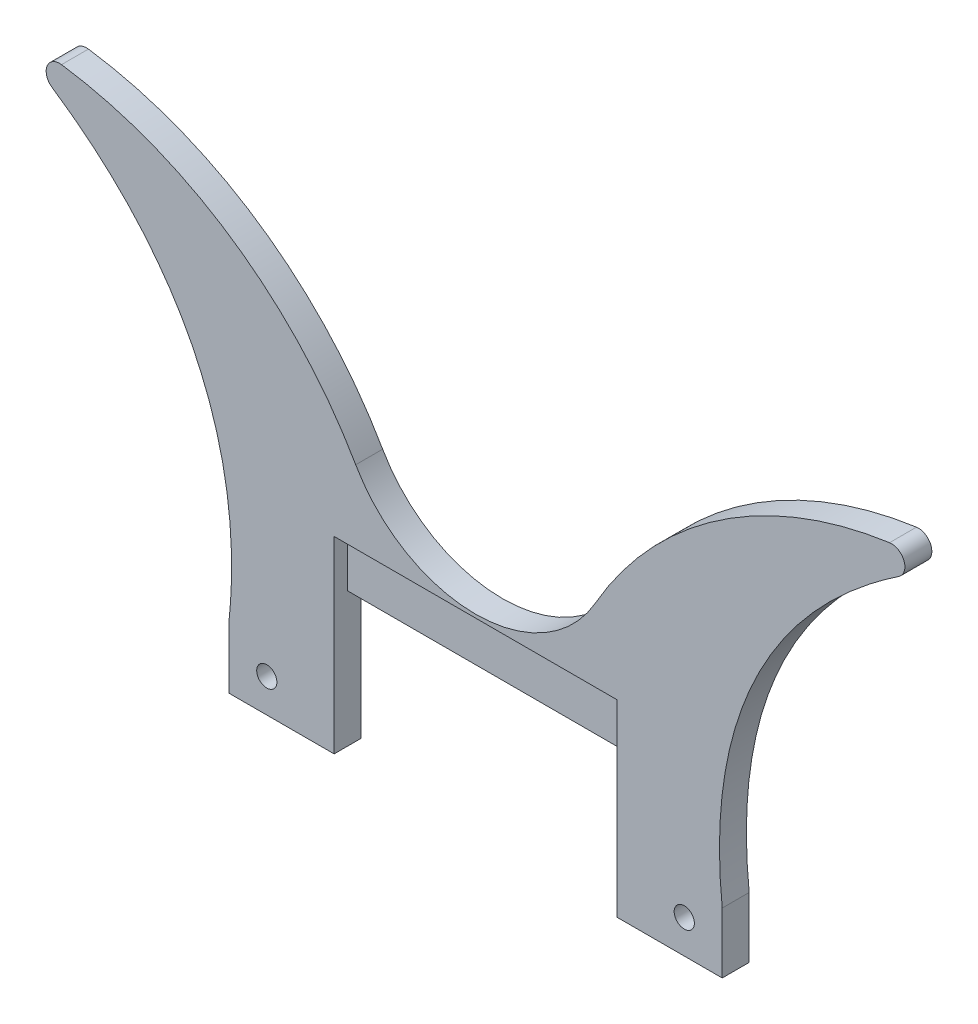
from build123d import *

# Parameters (mm, degrees)
EXTRUDE_1_DEPTH     = 3
SKETCH_2_W          = 42
SKETCH_2_H          = 10.974531836
CUT_EXTRUDE_1_DEPTH = 3
SKETCH_3_W          = 15.635920588
SKETCH_3_H          = 9
SKETCH_3_R          = 1.5
EXTRUDE_2_DEPTH     = 3
EXTRUDE_7_DEPTH     = 1
SKETCH_5_W          = 42
SKETCH_5_H          = 8
CUT_EXTRUDE_2_DEPTH = 1
SKETCH_6_R          = 1.5
CUT_EXTRUDE_3_DEPTH = 1


with BuildPart() as part:
    # 草图1 → 凸台-拉伸1 (new body)
    with BuildSketch(Plane.XY):
        with BuildLine():
            Line((36.635920588, -39.974531836), (-36.635920588, -39.974531836))
            add(Edge.make_bspline(
                [(-36.635920588, -39.974531836), (-34.121545097, -16.704406605), (-43.139592985, 2.527664637), (-62.878950173, 15.795774826)],
                knots=[0, 0, 0, 0, 0.89990839, 0.89990839, 0.89990839, 0.89990839], degree=3))
            ThreePointArc((-62.878950173, 15.795774826), (-63.630739893, 18.171500647), (-61.483579663, 19.436002094))
            ThreePointArc((-61.483579663, 19.436002094), (-36.207222823, 9.690254792), (-17.793837687, -10.179849722))
            ThreePointArc((-17.793837687, -10.179849722), (0, -20.5), (17.793837687, -10.179849722))
            ThreePointArc((17.793837687, -10.179849722), (36.207222823, 9.690254792), (61.483579663, 19.436002094))
            ThreePointArc((61.483579663, 19.436002094), (63.630739893, 18.171500647), (62.878950173, 15.795774826))
            add(Edge.make_bspline(
                [(36.635920588, -39.974531836), (34.121545097, -16.704406605), (43.139592985, 2.527664637), (62.878950173, 15.795774826)],
                knots=[0, 0, 0, 0, 0.89990839, 0.89990839, 0.89990839, 0.89990839], degree=3))
        make_face()
    extrude(amount=EXTRUDE_1_DEPTH)

    # 草图2 → 切除-拉伸1 (cut)
    with BuildSketch(Plane(origin=(0, 0, 0), x_dir=(-1, 0, 0), z_dir=(0, 0, -1))):
        with Locations((0, -34.487265918)):
            Rectangle(SKETCH_2_W, SKETCH_2_H)
    extrude(amount=-CUT_EXTRUDE_1_DEPTH, mode=Mode.SUBTRACT)

    # 草图3 → 凸台-拉伸2 (add)
    # profile 1 of 2: a face of its own
    with BuildSketch(Plane(origin=(0, 0, 0), x_dir=(-1, 0, 0), z_dir=(0, 0, -1))):
        with Locations((-28.817960294, -44.474531836)):
            Rectangle(SKETCH_3_W, SKETCH_3_H)
        with Locations((-31, -44)):
            Circle(SKETCH_3_R, mode=Mode.SUBTRACT)
    # profile 2 of 2: a face of its own
    with BuildSketch(Plane(origin=(0, 0, 0), x_dir=(-1, 0, 0), z_dir=(0, 0, -1))):
        with Locations((28.817960294, -44.474531836)):
            Rectangle(SKETCH_3_W, SKETCH_3_H)
        with Locations(Location((31, -44, 0), (0, 0, 180))):
            Circle(SKETCH_3_R, mode=Mode.SUBTRACT)
    extrude(amount=-EXTRUDE_2_DEPTH)

    # 草图4 → 凸台-拉伸7 (add)
    with BuildSketch(Plane.XY.offset(3)):
        with BuildLine():
            Line((-21, -29), (-21, -21))
            Line((-21, -21), (21, -21))
            Line((21, -21), (21, -29))
            Line((21, -29), (21, -48.974531836))
            Line((21, -48.974531836), (36.635920588, -48.974531836))
            Line((36.635920588, -48.974531836), (36.635920588, -39.974531836))
            add(Edge.make_bspline(
                [(36.635920588, -39.974531836), (34.121545097, -16.704406605), (43.139592985, 2.527664637), (62.878950173, 15.795774826)],
                knots=[0, 0, 0, 0, 0.89990839, 0.89990839, 0.89990839, 0.89990839], degree=3))
            ThreePointArc((62.878950173, 15.795774826), (63.630739893, 18.171500647), (61.483579663, 19.436002094))
            ThreePointArc((61.483579663, 19.436002094), (36.207222823, 9.690254792), (17.793837687, -10.179849722))
            ThreePointArc((17.793837687, -10.179849722), (0, -20.5), (-17.793837687, -10.179849722))
            ThreePointArc((-17.793837687, -10.179849722), (-36.207222823, 9.690254792), (-61.483579663, 19.436002094))
            ThreePointArc((-61.483579663, 19.436002094), (-63.630739893, 18.171500647), (-62.878950173, 15.795774826))
            add(Edge.make_bspline(
                [(-62.878950173, 15.795774826), (-43.139592985, 2.527664637), (-34.121545097, -16.704406605), (-36.635920588, -39.974531836)],
                knots=[0, 0, 0, 0, 0.89990839, 0.89990839, 0.89990839, 0.89990839], degree=3))
            Line((-36.635920588, -39.974531836), (-36.635920588, -48.974531836))
            Line((-36.635920588, -48.974531836), (-21, -48.974531836))
            Line((-21, -48.974531836), (-21, -29))
        make_face()
    extrude(amount=EXTRUDE_7_DEPTH)

    # 草图5 → 切除-拉伸2 (cut)
    with BuildSketch(Plane.XY.offset(3)):
        with Locations((0, -25)):
            Rectangle(SKETCH_5_W, SKETCH_5_H)
    extrude(amount=-CUT_EXTRUDE_2_DEPTH, mode=Mode.SUBTRACT)

    # 草图6 → 切除-拉伸3 (cut)
    with BuildSketch(Plane(origin=(0, 0, 3), x_dir=(-1, 0, 0), z_dir=(0, 0, -1))):
        with Locations((-31, -44)):
            Circle(SKETCH_6_R)
        with Locations((31, -44)):
            Circle(SKETCH_6_R)
    extrude(amount=-CUT_EXTRUDE_3_DEPTH, mode=Mode.SUBTRACT)


solid = part.part
